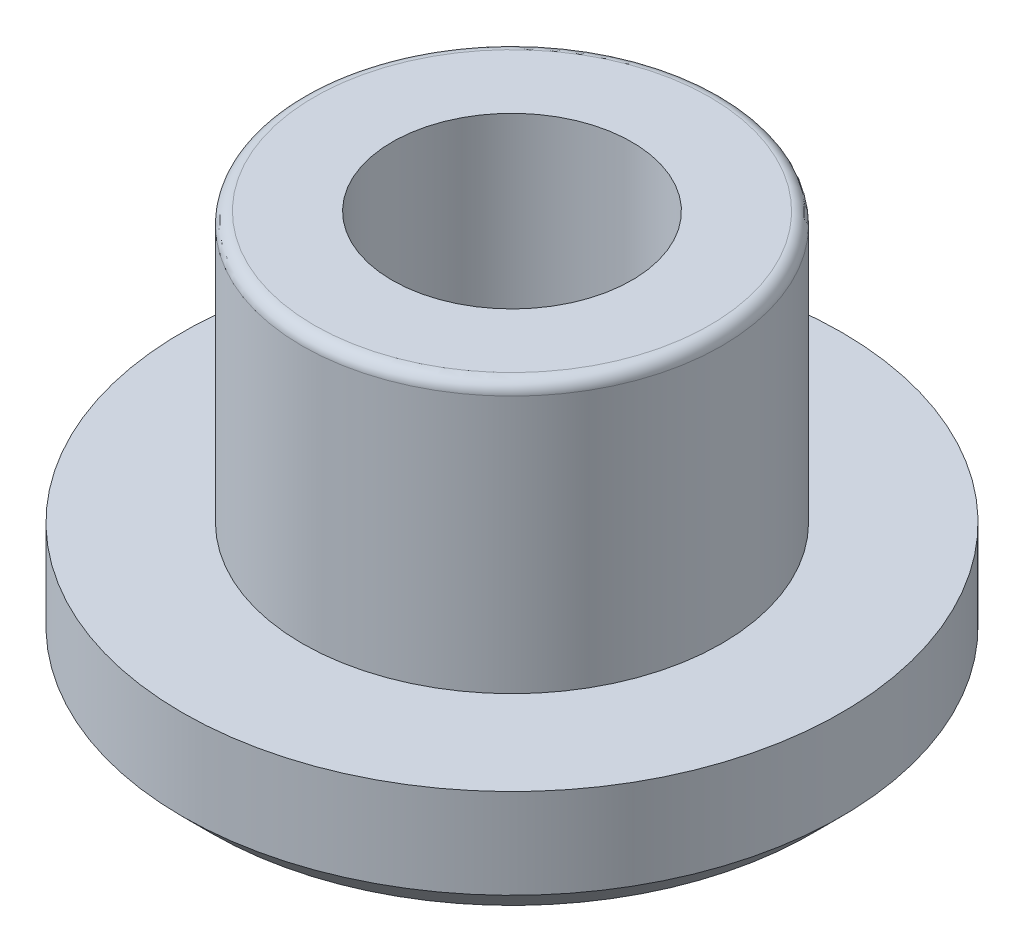
from build123d import *

# Parameters (mm, degrees)
SKETCH_1_R          = 5.5
EXTRUDE_1_DEPTH     = 2
SKETCH_2_R          = 3.5
EXTRUDE_2_DEPTH     = 4.5
SKETCH_3_R          = 2
CUT_EXTRUDE_1_DEPTH = 5
CHAMFER_1_SIZE      = 0.5
FILLET_1_R          = 0.2


with BuildPart() as part:
    # 草图1 → 凸台-拉伸1 (new body)
    with BuildSketch(Plane(origin=(0, 0, 0), x_dir=(1, 0, 0), z_dir=(0, 1, 0))):
        with Locations(Location((0, 0, 0), (0, 0, 270))):
            Circle(SKETCH_1_R)
    extrude(amount=EXTRUDE_1_DEPTH)

    # 草图2 → 凸台-拉伸2 (add)
    with BuildSketch(Plane(origin=(0, 2, 0), x_dir=(1, 0, 0), z_dir=(0, 1, 0))):
        with Locations(Location((0, 0, 0), (0, 0, 270))):
            Circle(SKETCH_2_R)
    extrude(amount=EXTRUDE_2_DEPTH)

    # 草图3 → 切除-拉伸1 (cut)
    with BuildSketch(Plane(origin=(0, 6.5, 0), x_dir=(1, 0, 0), z_dir=(0, 1, 0))):
        with Locations(Location((0, 0, 0), (0, 0, 270))):
            Circle(SKETCH_3_R)
    extrude(amount=-CUT_EXTRUDE_1_DEPTH, mode=Mode.SUBTRACT)

    # 倒角1
    chamfer_1_edges = [part.edges().sort_by_distance(p)[0] for p in [
        (0, 0, -5.5),
    ]]
    chamfer(chamfer_1_edges, length=CHAMFER_1_SIZE)

    # 圆角1
    fillet_1_edges = [part.edges().sort_by_distance(p)[0] for p in [
        (0, 6.5, -3.5),
    ]]
    fillet(fillet_1_edges, radius=FILLET_1_R)


solid = part.part
